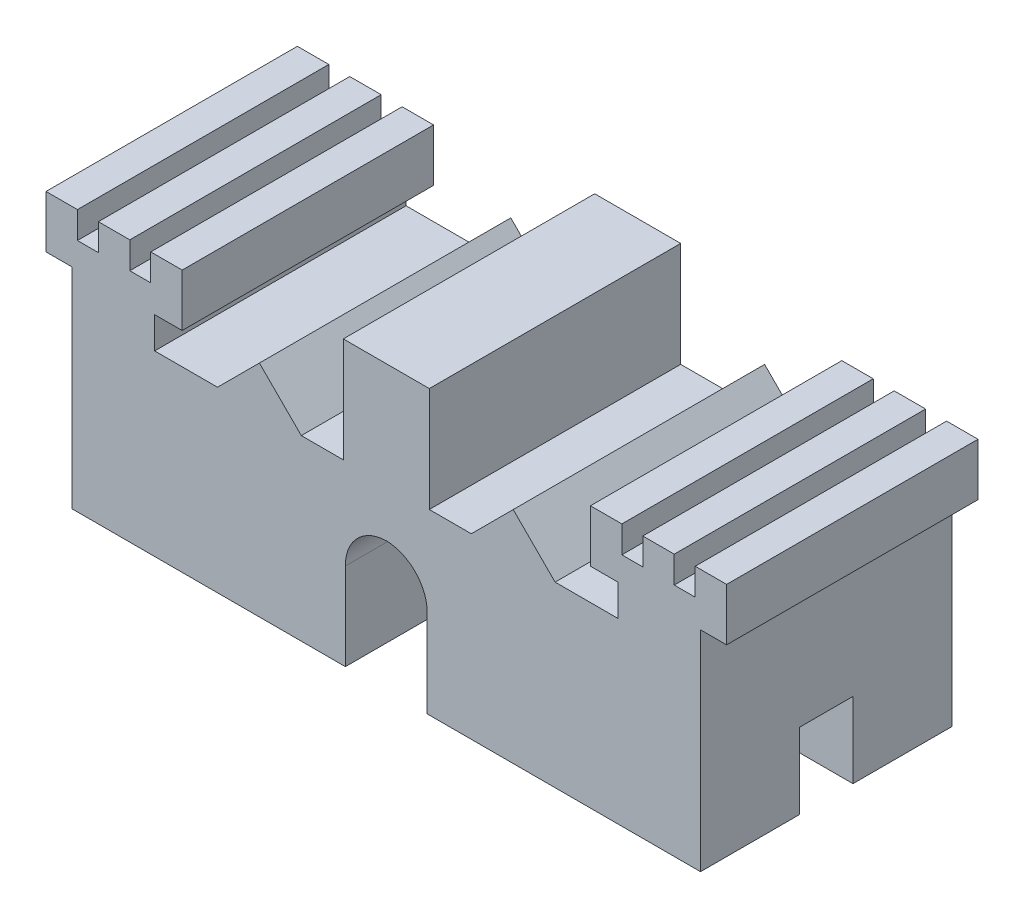
from build123d import *

# Parameters (mm, degrees)
BOSS_EXTRUDE1_DEPTH = 30.48
SKETCH4_W           = 6.48876247
SKETCH4_H           = 9.167377647
CUT_EXTRUDE2_DEPTH  = 92.667347591
CUT_EXTRUDE3_REACH  = 63.703


with BuildPart() as part:
    # Sketch1 → Boss-Extrude1 (new body)
    with BuildSketch(Plane.XY):
        Polygon((38.1, 0), (-38.1, 0), (-38.1, 25.4), (-41.260368664, 25.4), (-41.260368664, 31.75), (-37.450368664, 31.75), (-37.450368664, 28.501843318), (-34.910368664, 28.501843318), (-34.910368664, 31.75), (-31.100368664, 31.75), (-31.100368664, 28.501843318), (-28.560368664, 28.501843318), (-28.560368664, 31.75), (-24.750368664, 31.75), (-24.750368664, 25.4), (-28.086313364, 25.4), (-28.086313364, 21.59), (-20.466313364, 21.59), (-15.386313364, 26.67), (-10.306313364, 21.59), (-5.214608295, 21.59), (-5.214608295, 34.29), (5.214608295, 34.29), (5.214608295, 21.59), (10.306313364, 21.59), (15.386313364, 26.67), (20.466313364, 21.59), (28.086313364, 21.59), (28.086313364, 25.4), (24.750368664, 25.4), (24.750368664, 31.75), (28.560368664, 31.75), (28.560368664, 28.501843318), (31.100368664, 28.501843318), (31.100368664, 31.75), (34.910368664, 31.75), (34.910368664, 28.501843318), (37.450368664, 28.501843318), (37.450368664, 31.75), (41.260368664, 31.75), (41.260368664, 25.4), (38.1, 25.4), align=None)
    extrude(amount=BOSS_EXTRUDE1_DEPTH)

    # Sketch4 → Cut-Extrude2 (cut, through all)
    with BuildSketch(Plane.ZY.offset(38.1)):
        with Locations((15.24, 4.583688824)):
            Rectangle(SKETCH4_W, SKETCH4_H)
    extrude(amount=-CUT_EXTRUDE2_DEPTH, mode=Mode.SUBTRACT)

    # Cut-Extrude3: up to this face of the body (flat: up to its plane)
    cut_extrude3_end = Plane(part.part.faces().sort_by_distance((0, 4.583688824, 11.995618765))[0])
    # Sketch2<3> → Cut-Extrude3 (cut, up to the picked face)
    with BuildSketch(Plane.XY.offset(30.48), mode=Mode.PRIVATE) as cut_extrude3_sk1:
        with BuildLine():
            Line((4.958863186, 0), (-4.958863186, 0))
            Line((-4.958863186, 0), (-4.958863186, 10.574506278))
            ThreePointArc((-4.958863186, 10.574506278), (-3.540679592, 14.163599784), (0, 15.698664904))
            ThreePointArc((0, 15.698664904), (3.540679592, 14.163599784), (4.958863186, 10.574506278))
            Line((4.958863186, 10.574506278), (4.958863186, 0))
        make_face()
    cut_extrude3_tool1 = split(extrude(cut_extrude3_sk1.sketch, amount=-CUT_EXTRUDE3_REACH, mode=Mode.PRIVATE), bisect_by=cut_extrude3_end, keep=Keep.BOTH, mode=Mode.PRIVATE)
    add(cut_extrude3_tool1.solids().sort_by(Axis((0, 7.343248, 30.48), (0, 0, -1)))[0], mode=Mode.SUBTRACT)


solid = part.part
